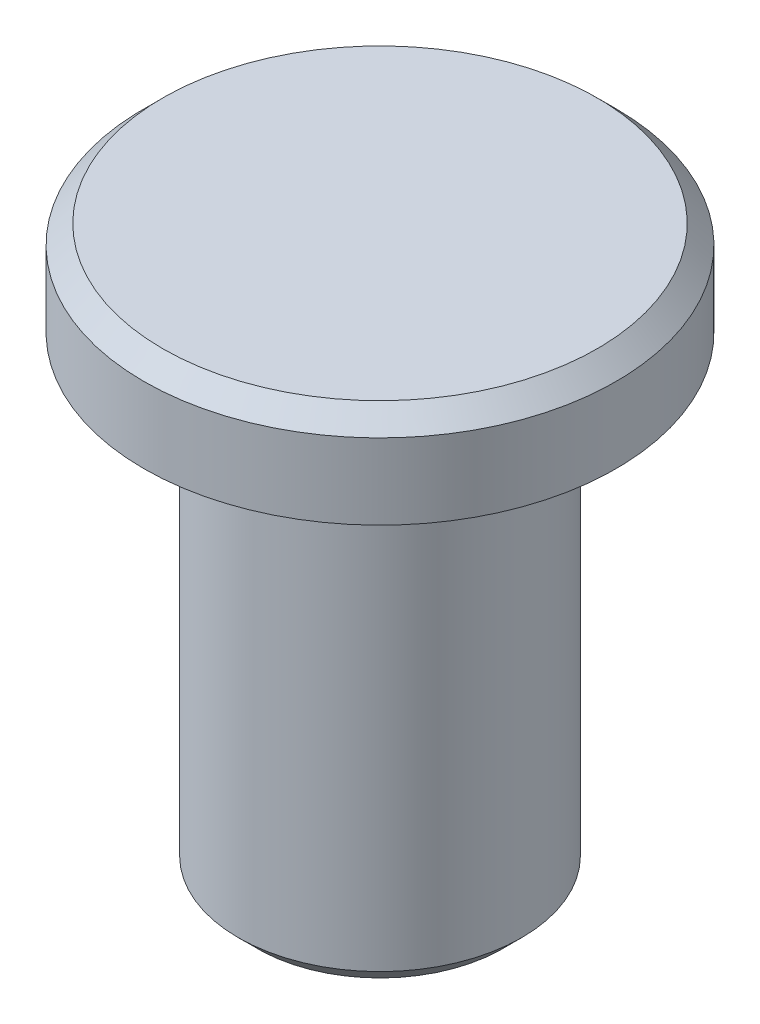
from build123d import *

# Parameters (mm, degrees)
CHAMFER2_SIZE = 0.2


with BuildPart() as part:
    # Sketch2 → Revolve1 (revolve)
    with BuildSketch(Plane.XY, mode=Mode.PRIVATE) as revolve1_sk:
        Polygon((0, 0), (0, 6), (2.5, 6), (2.5, 5), (1.5, 5), (1.5, 0), align=None)
    revolve(revolve1_sk.sketch.rotate(Axis((0, 0, 0), (0, 1, 0)), 90), axis=Axis((0, 0, 0), (0, 1, 0)))

    # Chamfer2
    chamfer2_edges = [part.edges().sort_by_distance(p)[0] for p in [
        (0, 0, 1.5),
        (0, 6, 2.5),
    ]]
    chamfer(chamfer2_edges, length=CHAMFER2_SIZE)


solid = part.part
